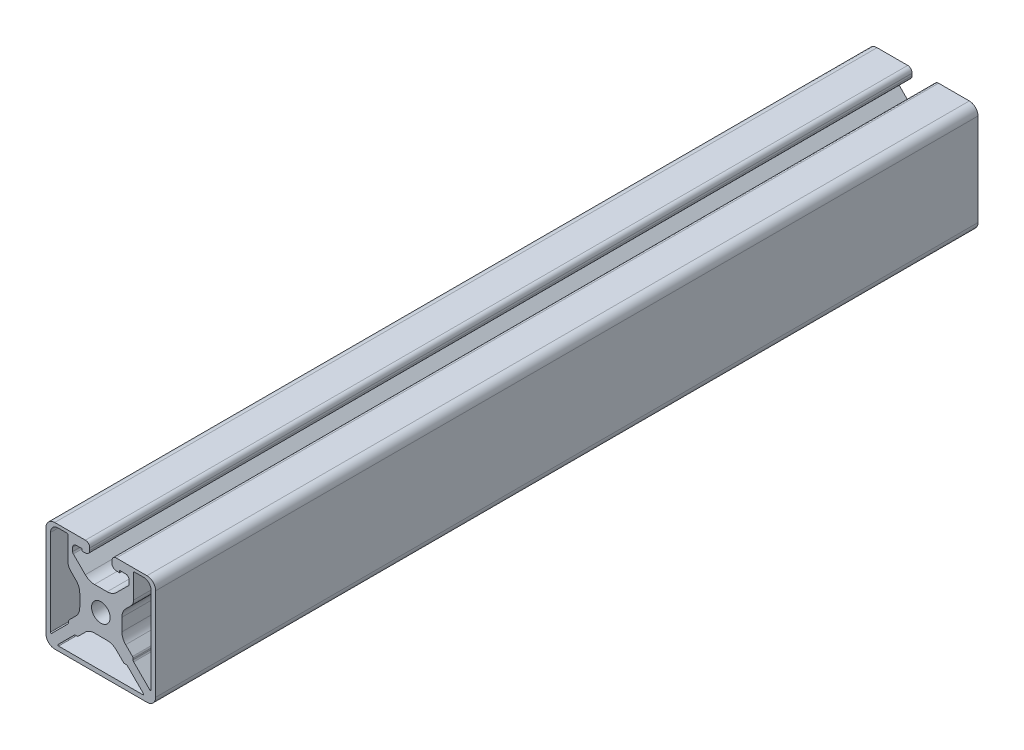
from build123d import *

# Parameters (mm, degrees)
SKETCH1_R      = 3.4
EXTRUDE1_DEPTH = 300


with BuildPart() as part:
    # Sketch1 → Extrude1 (new body)
    with BuildSketch(Plane.XY):
        with BuildLine():
            Line((16.824999974, 19.999999706), (5.628698889, 19.999999706))
            ThreePointArc((5.628698889, 19.999999706), (4.46721611, 19.488662348), (4.059999948, 18.286712625))
            Line((4.059999948, 18.286712625), (4.059999948, 17.5148))
            ThreePointArc((4.059999948, 17.5148), (4.521248189, 16.401248241), (5.634799948, 15.94))
            Line((5.634799948, 15.94), (6.872423693, 15.94))
            Line((6.872423693, 15.94), (6.899033319, 16.702000002))
            Line((6.899033319, 16.702000002), (9.014999977, 16.702000002))
            ThreePointArc((9.014999977, 16.702000002), (9.913025591, 16.330025613), (10.28499998, 15.431999998))
            Line((10.28499998, 15.431999998), (10.28499998, 14.064318961))
            ThreePointArc((10.28499998, 14.064318961), (10.217328883, 13.724113383), (10.024617903, 13.435701022))
            Line((10.024617903, 13.435701022), (5.665101027, 9.076184193))
            ThreePointArc((5.665101027, 9.076184193), (4.124155011, 8.046556992), (2.306485256, 7.685))
            Line((2.306485256, 7.685), (-2.306485308, 7.685))
            ThreePointArc((-2.306485308, 7.685), (-4.124155063, 8.046556992), (-5.665101079, 9.076184193))
            Line((-5.665101079, 9.076184193), (-10.024617955, 13.435701022))
            ThreePointArc((-10.024617955, 13.435701022), (-10.217328935, 13.724113383), (-10.285000032, 14.064318961))
            Line((-10.285000032, 14.064318961), (-10.285000032, 15.431999998))
            ThreePointArc((-10.285000032, 15.431999998), (-9.913025643, 16.330025613), (-9.015000029, 16.702000002))
            Line((-9.015000029, 16.702000002), (-6.899033371, 16.702000002))
            Line((-6.899033371, 16.702000002), (-6.872423745, 15.94))
            Line((-6.872423745, 15.94), (-5.6348, 15.94))
            ThreePointArc((-5.6348, 15.94), (-4.521248241, 16.401248241), (-4.06, 17.5148))
            Line((-4.06, 17.5148), (-4.06, 18.286712625))
            ThreePointArc((-4.06, 18.286712625), (-4.467216162, 19.488662348), (-5.628698941, 19.999999706))
            Line((-5.628698941, 19.999999706), (-16.825000026, 19.999999706))
            ThreePointArc((-16.825000026, 19.999999706), (-19.070064069, 19.070063731), (-20.000000044, 16.824999688))
            Line((-20.000000044, 16.824999688), (-20.000000044, -16.825000312))
            ThreePointArc((-20.000000044, -16.825000312), (-19.070064069, -19.070064355), (-16.825000026, -20.00000033))
            Line((-16.825000026, -20.00000033), (16.824999974, -20.00000033))
            ThreePointArc((16.824999974, -20.00000033), (19.070064017, -19.070064355), (19.999999992, -16.825000312))
            Line((19.999999992, -16.825000312), (19.999999992, 16.824999688))
            ThreePointArc((19.999999992, 16.824999688), (19.070064017, 19.070063731), (16.824999974, 19.999999706))
        make_face()
        Circle(SKETCH1_R, mode=Mode.SUBTRACT)
        with BuildLine():
            Line((-7.685000123, -2.306485221), (-7.685000123, 2.306485342))
            ThreePointArc((-7.685000123, 2.306485342), (-8.046557115, 4.124155098), (-9.076184316, 5.665101114))
            Line((-9.076184316, 5.665101114), (-11.032179452, 7.621096271))
            ThreePointArc((-11.032179452, 7.621096271), (-11.720432933, 8.651140405), (-11.962115415, 9.866160302))
            Line((-11.962115415, 9.866160302), (-11.962115415, 18.508608264))
            ThreePointArc((-11.962115415, 18.508608264), (-12.073707729, 18.778015942), (-12.343115407, 18.889608256))
            Line((-12.343115407, 18.889608256), (-15.556000031, 18.889608256))
            ThreePointArc((-15.556000031, 18.889608256), (-17.53165638, 18.071264601), (-18.350000035, 16.095608252))
            Line((-18.350000035, 16.095608252), (-18.350000035, -15.374719595))
            ThreePointArc((-18.350000035, -15.374719595), (-18.185883968, -15.620336647), (-17.8961589, -15.562706749))
            Line((-17.8961589, -15.562706749), (-11.992569935, -9.659117847))
            ThreePointArc((-11.992569935, -9.659117847), (-11.827389014, -9.411907131), (-11.769385188, -9.120302208))
            Line((-11.769385188, -9.120302208), (-11.769385188, -8.67393273))
            ThreePointArc((-11.769385188, -8.67393273), (-11.711381362, -8.382327807), (-11.546200441, -8.135117091))
            Line((-11.546200441, -8.135117091), (-9.076184352, -5.665101029))
            ThreePointArc((-9.076184352, -5.665101029), (-8.046557124, -4.124155), (-7.685000123, -2.306485221))
        make_face(mode=Mode.SUBTRACT)
        with BuildLine():
            Line((11.769385136, -8.67393273), (11.769385136, -9.120302208))
            ThreePointArc((11.769385136, -9.120302208), (11.827388962, -9.411907131), (11.992569883, -9.659117847))
            Line((11.992569883, -9.659117847), (17.896158848, -15.562706749))
            ThreePointArc((17.896158848, -15.562706749), (18.185883916, -15.620336647), (18.349999983, -15.374719595))
            Line((18.349999983, -15.374719595), (18.349999983, 16.095608252))
            ThreePointArc((18.349999983, 16.095608252), (17.531656328, 18.071264601), (15.555999979, 18.889608256))
            Line((15.555999979, 18.889608256), (12.343115355, 18.889608256))
            ThreePointArc((12.343115355, 18.889608256), (12.073707677, 18.778015942), (11.962115363, 18.508608264))
            Line((11.962115363, 18.508608264), (11.962115363, 9.866160302))
            ThreePointArc((11.962115363, 9.866160302), (11.720432881, 8.651140405), (11.0321794, 7.621096271))
            Line((11.0321794, 7.621096271), (9.076184264, 5.665101114))
            ThreePointArc((9.076184264, 5.665101114), (8.046557063, 4.124155098), (7.685000071, 2.306485342))
            Line((7.685000071, 2.306485342), (7.685000071, -2.306485221))
            ThreePointArc((7.685000071, -2.306485221), (8.046557072, -4.124155), (9.0761843, -5.665101029))
            Line((9.0761843, -5.665101029), (11.546200389, -8.135117091))
            ThreePointArc((11.546200389, -8.135117091), (11.71138131, -8.382327807), (11.769385136, -8.67393273))
        make_face(mode=Mode.SUBTRACT)
        with BuildLine():
            Line((15.588203795, -17.921655982), (9.729110898, -12.062563022))
            ThreePointArc((9.729110898, -12.062563022), (9.481900182, -11.897382101), (9.190295259, -11.839378275))
            Line((9.190295259, -11.839378275), (8.743925781, -11.839378275))
            ThreePointArc((8.743925781, -11.839378275), (8.452320858, -11.781374449), (8.205110142, -11.616193528))
            Line((8.205110142, -11.616193528), (5.665101063, -9.076184423))
            ThreePointArc((5.665101063, -9.076184423), (4.124155035, -8.046557195), (2.306485256, -7.685000194))
            Line((2.306485256, -7.685000194), (-2.306485308, -7.685000194))
            ThreePointArc((-2.306485308, -7.685000194), (-4.124155087, -8.046557195), (-5.665101115, -9.076184423))
            Line((-5.665101115, -9.076184423), (-8.205110194, -11.616193528))
            ThreePointArc((-8.205110194, -11.616193528), (-8.45232091, -11.781374449), (-8.743925833, -11.839378275))
            Line((-8.743925833, -11.839378275), (-9.190295311, -11.839378275))
            ThreePointArc((-9.190295311, -11.839378275), (-9.481900233, -11.897382101), (-9.72911095, -12.062563022))
            Line((-9.72911095, -12.062563022), (-15.588203847, -17.921655982))
            ThreePointArc((-15.588203847, -17.921655982), (-15.64259606, -18.195104108), (-15.410777932, -18.350000028))
            Line((-15.410777932, -18.350000028), (15.41077788, -18.350000028))
            ThreePointArc((15.41077788, -18.350000028), (15.642596008, -18.195104108), (15.588203795, -17.921655982))
        make_face(mode=Mode.SUBTRACT)
    extrude(amount=-EXTRUDE1_DEPTH)


solid = part.part
